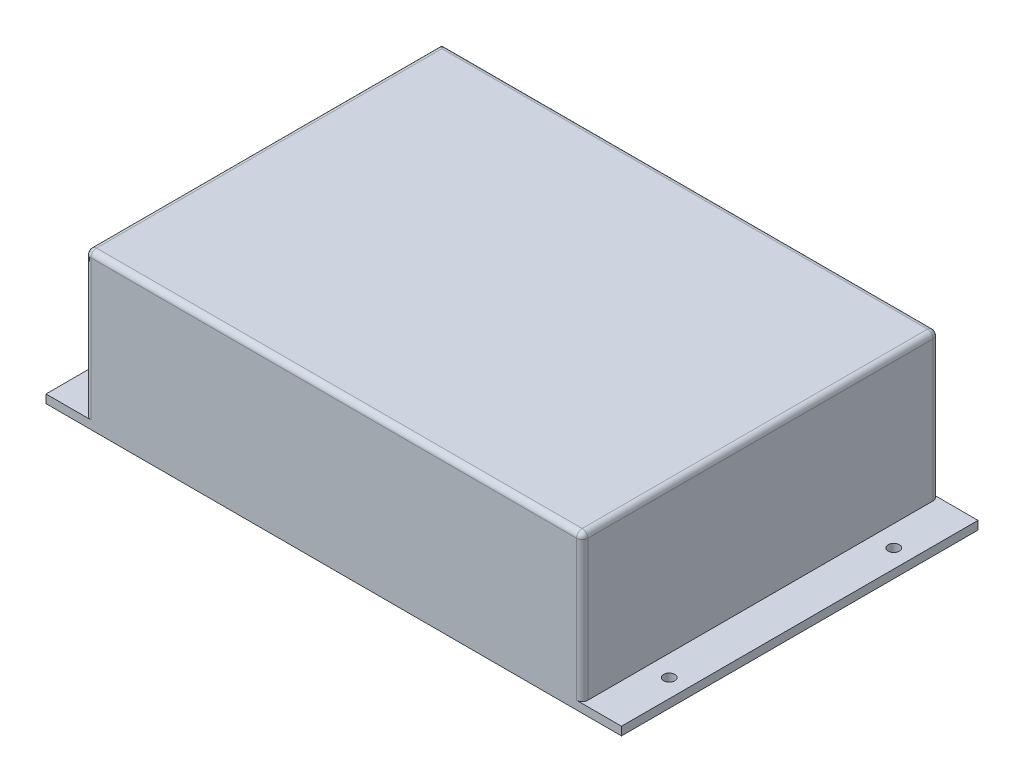
from build123d import *

# Parameters (mm, degrees)
SKETCH_2_W      = 205
SKETCH_2_H      = 127
SKETCH_2_R      = 2
EXTRUDE_1_DEPTH = 3
SKETCH_3_W      = 177
SKETCH_3_H      = 127
EXTRUDE_2_DEPTH = 52
FILLET_1_R      = 2


with BuildPart() as part:
    # 草图2 → 凸台-拉伸1 (new body)
    with BuildSketch(Plane(origin=(0, 0, 0), x_dir=(1, 0, 0), z_dir=(0, 1, 0))):
        Rectangle(SKETCH_2_W, SKETCH_2_H)
        with Locations(Location((-96, 40, 0), (0, 0, 270))):
            Circle(SKETCH_2_R, mode=Mode.SUBTRACT)
        with Locations(Location((96, 40, 0), (0, 0, 270))):
            Circle(SKETCH_2_R, mode=Mode.SUBTRACT)
        with Locations(Location((96, -40, 0), (0, 0, 270))):
            Circle(SKETCH_2_R, mode=Mode.SUBTRACT)
        with Locations(Location((-96, -40, 0), (0, 0, 270))):
            Circle(SKETCH_2_R, mode=Mode.SUBTRACT)
    extrude(amount=EXTRUDE_1_DEPTH)

    # 草图3 → 凸台-拉伸2 (add)
    with BuildSketch(Plane(origin=(0, 3, 0), x_dir=(1, 0, 0), z_dir=(0, 1, 0))):
        Rectangle(SKETCH_3_W, SKETCH_3_H)
    extrude(amount=EXTRUDE_2_DEPTH)

    # 圆角1
    fillet_1_edges = [part.edges().sort_by_distance(p)[0] for p in [
        (-88.5, 29, 63.5),
        (88.5, 29, 63.5),
        (88.5, 29, -63.5),
        (-88.5, 55, 0),
        (0, 55, 63.5),
        (88.5, 55, 0),
        (0, 55, -63.5),
    ]]
    fillet(fillet_1_edges, radius=FILLET_1_R)


solid = part.part
